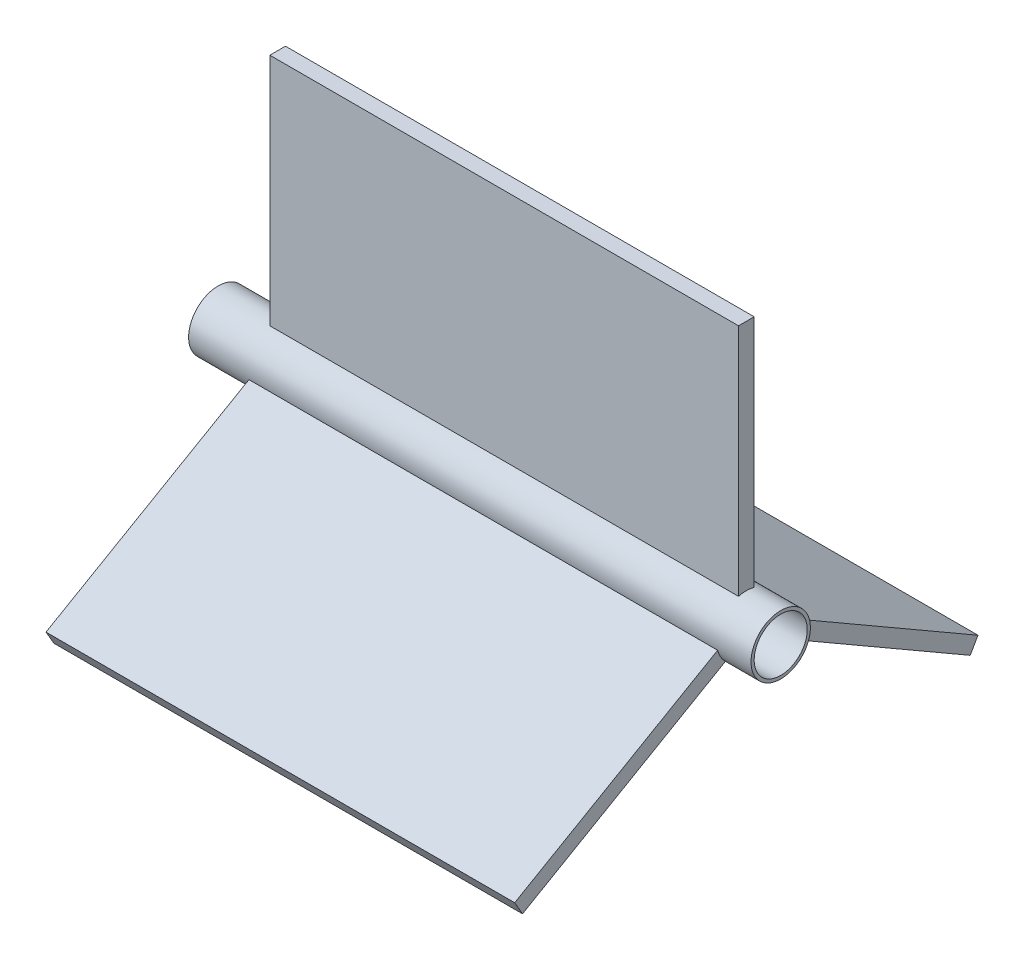
from build123d import *

# Parameters (mm, degrees)
CROQUIS1_R              = 9.5
SALIENTE_EXTRUIR1_DEPTH = 180
SALIENTE_EXTRUIR2_START = -169
CROQUIS2_W              = 5
CROQUIS2_H              = 75
SALIENTE_EXTRUIR2_DEPTH = 150
CROQUIS3_R              = 8.5
CORTAR_EXTRUIR1_DEPTH   = 213.085802537


with BuildPart() as part:
    # Croquis1 → Saliente-Extruir1 (new body)
    with BuildSketch(Plane(origin=(0, 0, 0), x_dir=(0, 0, -1), z_dir=(1, 0, 0))):
        with Locations(Location((0, 0, 0), (0, 0, 180))):
            Circle(CROQUIS1_R)
    extrude(amount=SALIENTE_EXTRUIR1_DEPTH)

    # Croquis2 → Saliente-Extruir2 (add)
    with BuildSketch(Plane.ZY.offset(SALIENTE_EXTRUIR2_START)):
        Polygon((74.139159217, -39.917512185), (71.639159217, -44.247639204), (6.687253933, -6.747639204), (9.187253933, -2.417512185), align=None)
        with Locations((0, 46.66515139)):
            Rectangle(CROQUIS2_W, CROQUIS2_H)
        Polygon((-71.639159217, -44.247639204), (-74.139159217, -39.917512185), (-9.187253933, -2.417512185), (-6.687253933, -6.747639204), align=None)
    extrude(amount=SALIENTE_EXTRUIR2_DEPTH)

    # Croquis3 → Cortar-Extruir1 (cut, through all)
    with BuildSketch(Plane.ZY):
        Circle(CROQUIS3_R)
    extrude(amount=-CORTAR_EXTRUIR1_DEPTH, mode=Mode.SUBTRACT)


solid = part.part
